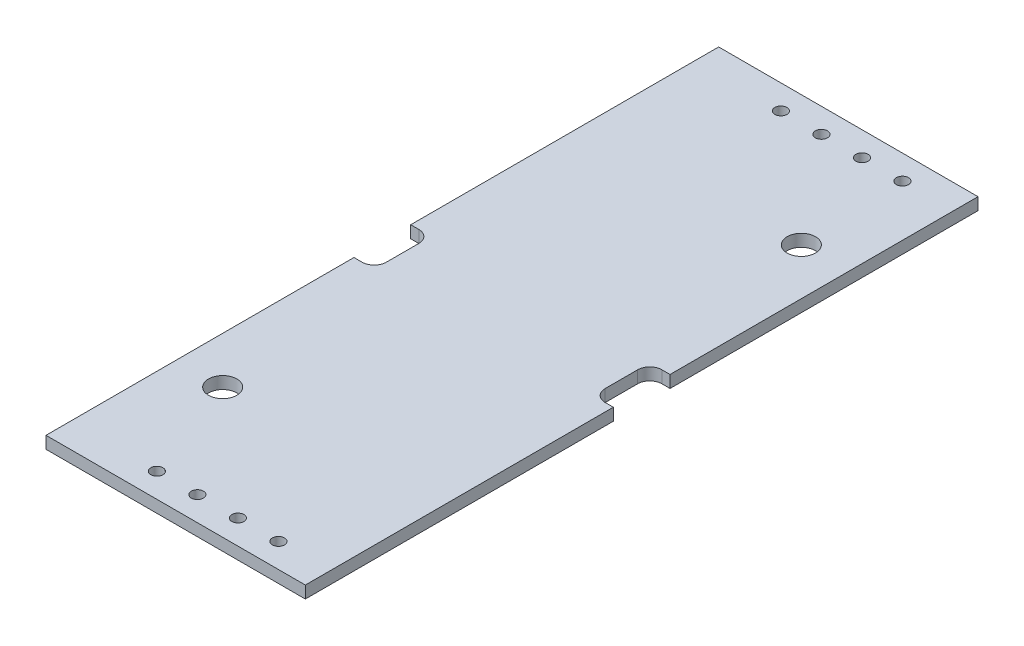
from build123d import *

# Parameters (mm, degrees)
EXTRUDE_1_DEPTH        = 1.5
HOLE_WIZARD_2_D        = 3.5
HOLE_WIZARD_4_D        = 1.5
PATTERN_LINEAR_2_COUNT = 4
PATTERN_LINEAR_2_PITCH = 5


with BuildPart() as part:
    # Эскиз1 → Вытянуть1 (new body)
    with BuildSketch(Plane(origin=(0, 0, 0), x_dir=(1, 0, 0), z_dir=(0, 1, 0))):
        with BuildLine():
            Line((-16, 41.5), (16, 41.5))
            Line((16, 41.5), (16, 3.5))
            Line((16, 3.5), (15, 3.5))
            ThreePointArc((15, 3.5), (13.939339828, 3.060660172), (13.5, 2))
            Line((13.5, 2), (13.5, -2))
            ThreePointArc((13.5, -2), (13.939339828, -3.060660172), (15, -3.5))
            Line((15, -3.5), (16, -3.5))
            Line((16, -3.5), (16, -41.5))
            Line((16, -41.5), (-16, -41.5))
            Line((-16, -41.5), (-16, -3.5))
            Line((-16, -3.5), (-15, -3.5))
            ThreePointArc((-15, -3.5), (-13.939339828, -3.060660172), (-13.5, -2))
            Line((-13.5, -2), (-13.5, 2))
            ThreePointArc((-13.5, 2), (-13.939339828, 3.060660172), (-15, 3.5))
            Line((-15, 3.5), (-16, 3.5))
            Line((-16, 3.5), (-16, 41.5))
        make_face()
    extrude(amount=EXTRUDE_1_DEPTH)

    # Отверстие2 (through all)
    with Locations(Plane(origin=(10.25, 1.5, -25.45), x_dir=(0, 0, 1), z_dir=(0, 1, 0))):
        with Locations((0, 0), (50.9, -20.5)):
            Hole(HOLE_WIZARD_2_D / 2)

    # Отверстие4 (through all)
    with Locations(Plane(origin=(9.68, 1.5, -38.5), x_dir=(0, 0, 1), z_dir=(0, 1, 0))):
        with Locations((0, 0), (77, 0)):
            hole_wizard_4 = Hole(HOLE_WIZARD_4_D / 2)

    # Линейный массив2: Отверстие4 ×4
    with Locations(*[(-i * PATTERN_LINEAR_2_PITCH, 0, 0) for i in range(1, PATTERN_LINEAR_2_COUNT)]):
        add(hole_wizard_4, mode=Mode.SUBTRACT)


solid = part.part
